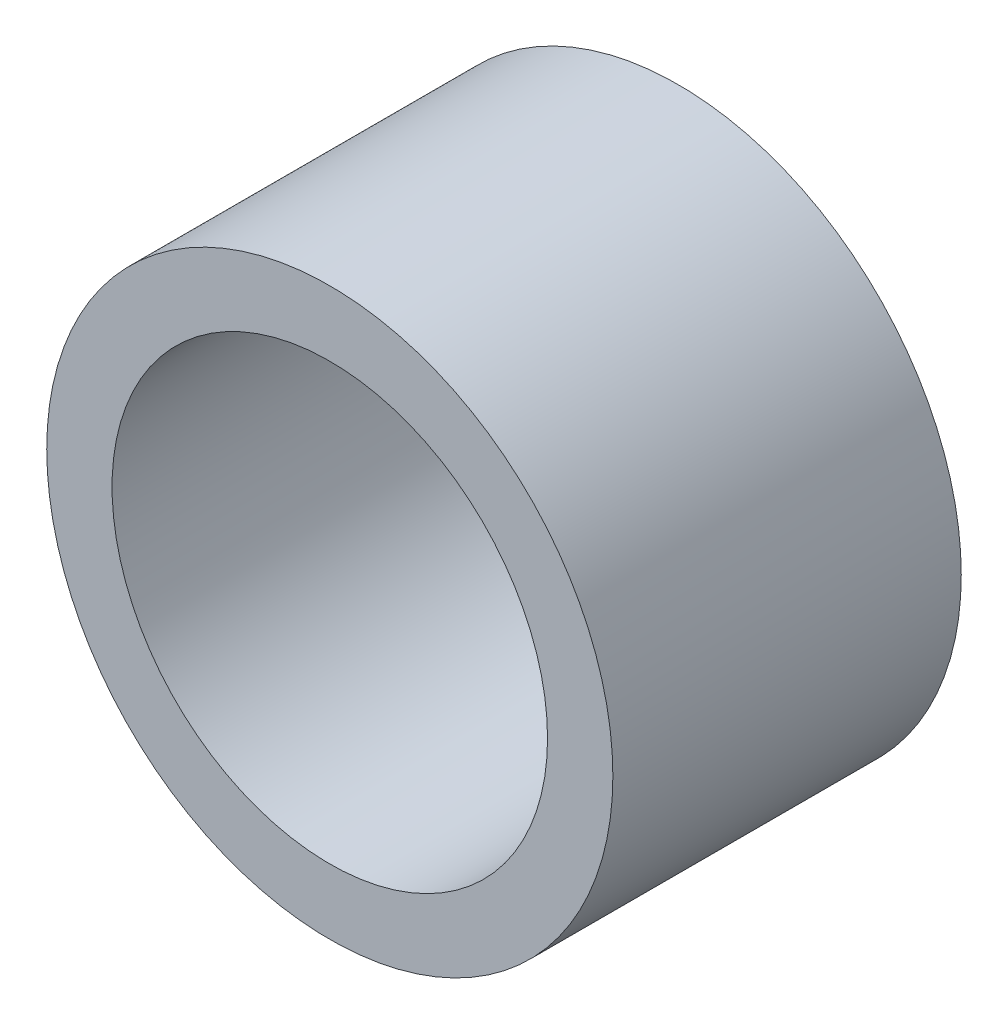
from build123d import *

# Parameters (mm, degrees)
SKETCH1_R           = 10.31875
SKETCH1_R_2         = 7.9375
BOSS_EXTRUDE1_DEPTH = 12.7


with BuildPart() as part:
    # Sketch1 → Boss-Extrude1 (new body)
    with BuildSketch(Plane.XY):
        Circle(SKETCH1_R)
        Circle(SKETCH1_R_2, mode=Mode.SUBTRACT)
    extrude(amount=BOSS_EXTRUDE1_DEPTH)


solid = part.part
